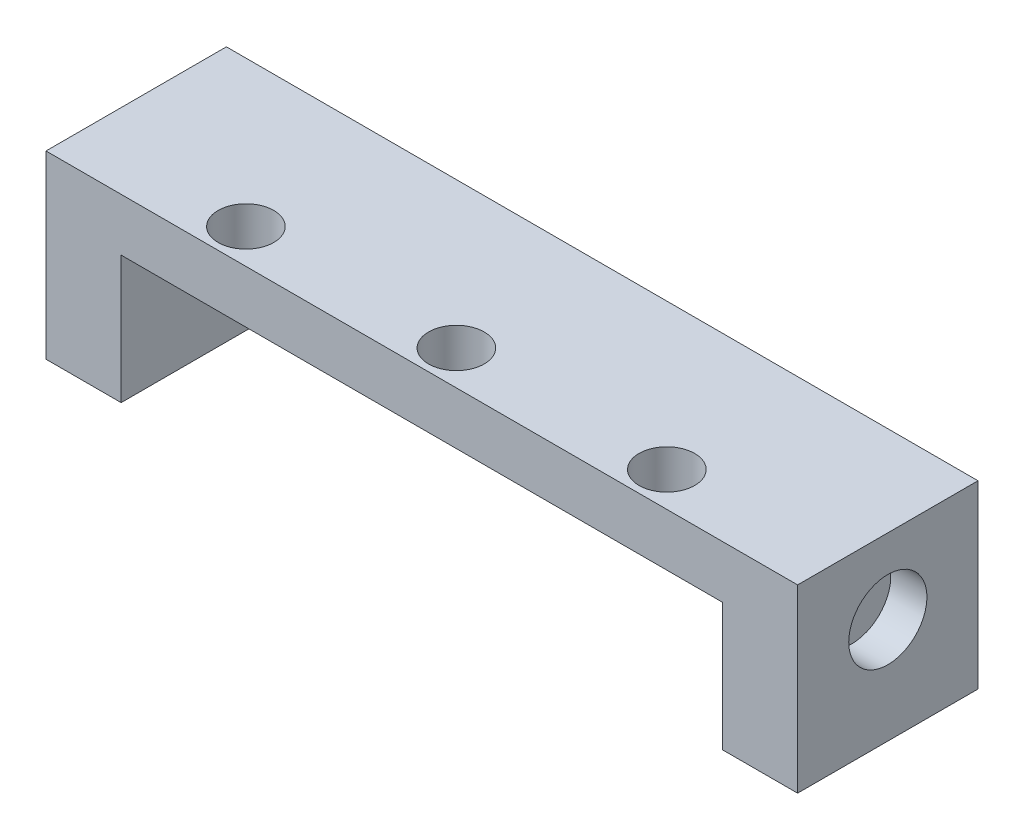
from build123d import *

# Parameters (mm, degrees)
SKETCH1_W           = 54
SKETCH1_H           = 59
SKETCH1_W_2         = 40
SKETCH1_H_2         = 52
BOSS_EXTRUDE1_DEPTH = 12
SKETCH2_R           = 1.85
CUT_EXTRUDE1_DEPTH  = 10
SKETCH3_R           = 1.85
CUT_EXTRUDE2_DEPTH  = 10
SKETCH4_W           = 54
SKETCH4_H           = 12
CUT_EXTRUDE4_DEPTH  = 40
SKETCH5_W           = 7
SKETCH5_H           = 12
CUT_EXTRUDE5_DEPTH  = 40
SKETCH6_W           = 12
SKETCH6_H           = 12
BOSS_EXTRUDE2_DEPTH = 5
SKETCH7_R           = 2.6
CUT_EXTRUDE6_DEPTH  = 2.4


with BuildPart() as part:
    # Sketch1 → Boss-Extrude1 (new body)
    with BuildSketch(Plane.XY):
        with Locations((27, 29.5)):
            Rectangle(SKETCH1_W, SKETCH1_H)
        with Locations((27, 29.5)):
            Rectangle(SKETCH1_W_2, SKETCH1_H_2, mode=Mode.SUBTRACT)
    extrude(amount=BOSS_EXTRUDE1_DEPTH)

    # Sketch2 → Cut-Extrude1 (cut)
    with BuildSketch(Plane(origin=(0, 59, 0), x_dir=(1, 0, 0), z_dir=(0, 1, 0))):
        with Locations(Location((13, -9.7, 0), (0, 0, 180))):
            Circle(SKETCH2_R)
        with Locations(Location((41, -9.7, 0), (0, 0, 180))):
            Circle(SKETCH2_R)
        with Locations(Location((27, -9.7, 0), (0, 0, 180))):
            Circle(SKETCH2_R)
    extrude(amount=-CUT_EXTRUDE1_DEPTH, mode=Mode.SUBTRACT)

    # Sketch3 → Cut-Extrude2 (cut)
    with BuildSketch(Plane.XZ):
        with Locations(Location((12.75, 6, 0), (0, 0, 270))):
            Circle(SKETCH3_R)
        with Locations(Location((41.25, 6, 0), (0, 0, 90))):
            Circle(SKETCH3_R)
    extrude(amount=-CUT_EXTRUDE2_DEPTH, mode=Mode.SUBTRACT)

    # Sketch4 → Cut-Extrude4 (cut)
    with BuildSketch(Plane.XZ):
        with Locations((27, 6)):
            Rectangle(SKETCH4_W, SKETCH4_H)
    extrude(amount=-CUT_EXTRUDE4_DEPTH, mode=Mode.SUBTRACT)

    # Sketch5 → Cut-Extrude5 (cut)
    with BuildSketch(Plane.XZ.offset(-40)):
        with Locations((3.5, 6)):
            Rectangle(SKETCH5_W, SKETCH5_H)
        with Locations((50.5, 6)):
            Rectangle(SKETCH5_W, SKETCH5_H)
    extrude(amount=-CUT_EXTRUDE5_DEPTH, mode=Mode.SUBTRACT)

    # Sketch6 → Boss-Extrude2 (add)
    with BuildSketch(Plane(origin=(47, 0, 0), x_dir=(0, 0, -1), z_dir=(1, 0, 0))):
        with Locations((-6, 53)):
            Rectangle(SKETCH6_W, SKETCH6_H)
    boss_extrude2 = extrude(amount=BOSS_EXTRUDE2_DEPTH)

    # Mirror1: Boss-Extrude2 across plane
    add(boss_extrude2.mirror(Plane.ZY.offset(-27)))

    # Sketch7 → Cut-Extrude6 (cut)
    with BuildSketch(Plane.ZY.offset(-2)):
        with Locations((6, 54)):
            Circle(SKETCH7_R)
    cut_extrude6 = extrude(amount=-CUT_EXTRUDE6_DEPTH, mode=Mode.SUBTRACT)

    # Mirror2: Cut-Extrude6 across plane
    add(cut_extrude6.mirror(Plane.ZY.offset(-27)), mode=Mode.SUBTRACT)


solid = part.part
